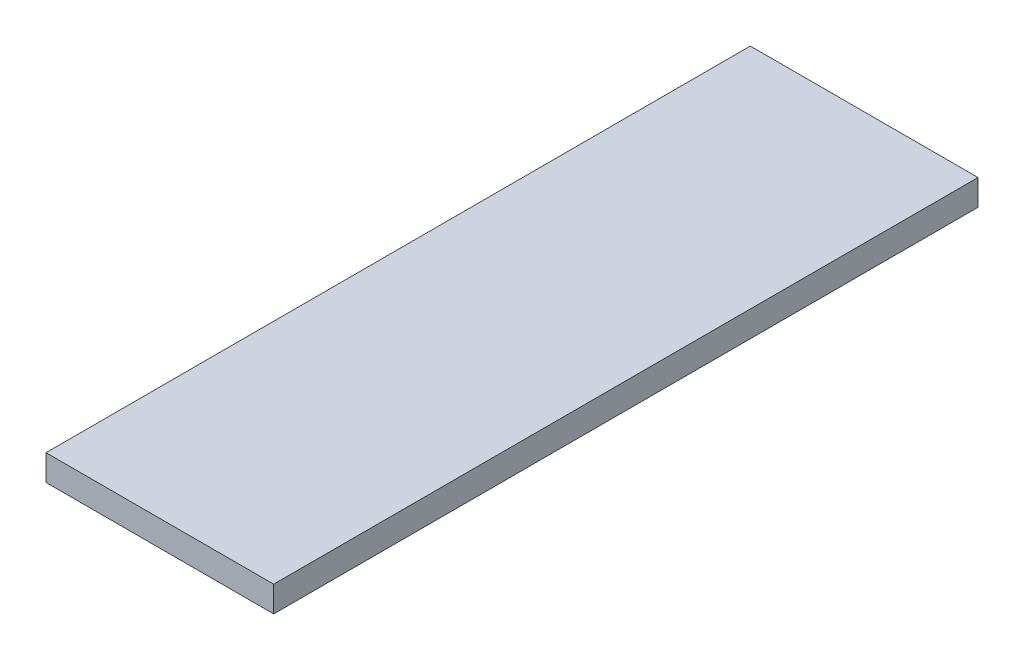
from build123d import *

# Parameters (mm, degrees)
SKETCH1_W           = 150
SKETCH1_H           = 17
BOSS_EXTRUDE1_DEPTH = 464


with BuildPart() as part:
    # Sketch1 → Boss-Extrude1 (new body)
    with BuildSketch(Plane.XY):
        with Locations((155, -392)):
            Rectangle(SKETCH1_W, SKETCH1_H)
    extrude(amount=BOSS_EXTRUDE1_DEPTH)


solid = part.part
